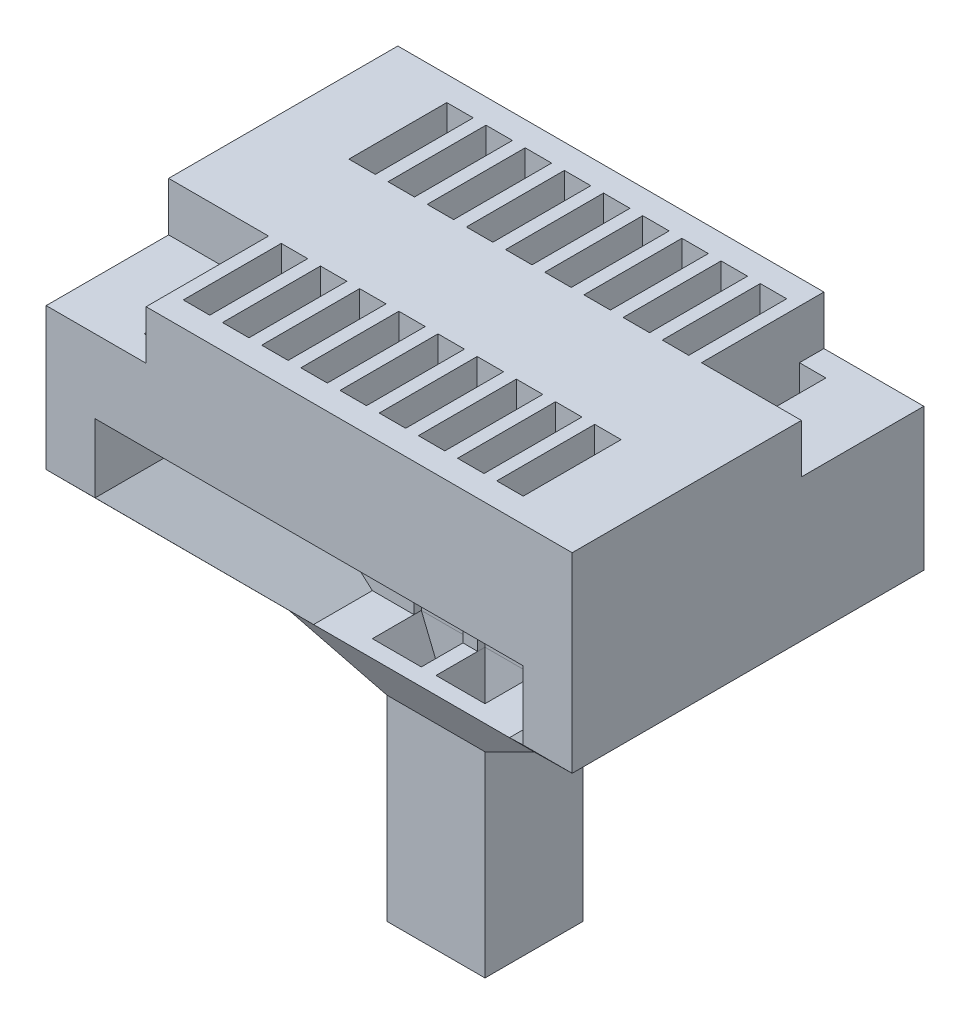
from build123d import *

# Parameters (mm, degrees)
MAIN_BLOCK_W               = 5.37
MAIN_BLOCK_H               = 3.59
MAIN_WELL_BLOCK_DEPTH      = 1.25
WELL_SKETCH_W              = 0.27
WELL_SKETCH_H              = 1
WELLS_DEPTH                = 2.54
SUPPORT_BEAMS_W            = 0.5
SUPPORT_BEAMS_H            = 3.59
SUPPORT_BEAMS_EXTR_DEPTH   = 0.7
WALL_DIVIDER_SKETCH_W      = 4.37
WALL_DIVIDER_SKETCH_H      = 0.3
DIVIDER_WALL_EXTR_DEPTH    = 0.7
LOWER_EXIT_BASE_SKETCH_2_W = 1
LOWER_EXIT_BASE_SKETCH_2_H = 1
TETRODE_GUIDE_TUBE_DEPTH   = 2
MID_TETRODE_HOLES_6_W      = 0.32
MID_TETRODE_HOLES_6_H      = 0.32
CUT_EXTRUDE3_DEPTH         = 2
TETRODE_GUIDE_TOP_8_W      = 0.5
TETRODE_GUIDE_TOP_8_H      = 0.5
CUT_EXTRUDE4_DEPTH         = 0.5
SKETCH9_W                  = 1.020059297
SKETCH9_H                  = 1.25
SKETCH9_W_2                = 1.02
GND_EXTR_DEPTH             = 0.5


with BuildPart() as part:
    # main block → Main Well Block (new body)
    with BuildSketch(Plane(origin=(0, 0, 0), x_dir=(1, 0, 0), z_dir=(0, 1, 0))):
        Rectangle(MAIN_BLOCK_W, MAIN_BLOCK_H)
    extrude(amount=-MAIN_WELL_BLOCK_DEPTH)

    # well sketch → wells (cut)
    with BuildSketch(Plane(origin=(0, 0, 0), x_dir=(1, 0, 0), z_dir=(0, 1, 0))):
        with Locations((1.8, 1.045)):
            Rectangle(WELL_SKETCH_W, WELL_SKETCH_H)
        with Locations((1.400006589, 1.045)):
            Rectangle(WELL_SKETCH_W, WELL_SKETCH_H)
        with Locations((1.000013177, 1.045)):
            Rectangle(WELL_SKETCH_W, WELL_SKETCH_H)
        with Locations((0.600019766, 1.045)):
            Rectangle(WELL_SKETCH_W, WELL_SKETCH_H)
        with Locations((0.200026354, 1.045)):
            Rectangle(WELL_SKETCH_W, WELL_SKETCH_H)
        with Locations((-0.199967057, 1.045)):
            Rectangle(WELL_SKETCH_W, WELL_SKETCH_H)
        with Locations((-0.599960468, 1.045)):
            Rectangle(WELL_SKETCH_W, WELL_SKETCH_H)
        with Locations((-0.99995388, 1.045)):
            Rectangle(WELL_SKETCH_W, WELL_SKETCH_H)
        with Locations((-1.399947291, 1.045)):
            Rectangle(WELL_SKETCH_W, WELL_SKETCH_H)
        with Locations((-1.799940703, 1.045)):
            Rectangle(WELL_SKETCH_W, WELL_SKETCH_H)
        with Locations((1.400006589, -1.045)):
            Rectangle(WELL_SKETCH_W, WELL_SKETCH_H)
        with Locations((1.000013177, -1.045)):
            Rectangle(WELL_SKETCH_W, WELL_SKETCH_H)
        with Locations((0.600019766, -1.045)):
            Rectangle(WELL_SKETCH_W, WELL_SKETCH_H)
        with Locations((0.200026354, -1.045)):
            Rectangle(WELL_SKETCH_W, WELL_SKETCH_H)
        with Locations((-0.199967057, -1.045)):
            Rectangle(WELL_SKETCH_W, WELL_SKETCH_H)
        with Locations((-0.599960468, -1.045)):
            Rectangle(WELL_SKETCH_W, WELL_SKETCH_H)
        with Locations((-0.99995388, -1.045)):
            Rectangle(WELL_SKETCH_W, WELL_SKETCH_H)
        with Locations((-1.399947291, -1.045)):
            Rectangle(WELL_SKETCH_W, WELL_SKETCH_H)
        with Locations((-1.799940703, -1.045)):
            Rectangle(WELL_SKETCH_W, WELL_SKETCH_H)
        with Locations((1.8, -1.045)):
            Rectangle(WELL_SKETCH_W, WELL_SKETCH_H)
    extrude(amount=-WELLS_DEPTH, mode=Mode.SUBTRACT)

    # support beams → support beams extr (add)
    with BuildSketch(Plane.XZ.offset(1.25)):
        with Locations((-2.435, 0)):
            Rectangle(SUPPORT_BEAMS_W, SUPPORT_BEAMS_H)
        with Locations((2.435, 0)):
            Rectangle(SUPPORT_BEAMS_W, SUPPORT_BEAMS_H)
    extrude(amount=SUPPORT_BEAMS_EXTR_DEPTH)

    # Sketch6 → section 1 of arm1
    with BuildSketch(Plane(origin=(0, -3, 0), x_dir=(1, 0, 0), z_dir=(0, 1, 0)), mode=Mode.PRIVATE) as arm1_s1:
        with BuildLine():
            Line((-1.25, 0.75), (-1, 0.75))
            Line((-1, 0.75), (-1, -0.75))
            Line((-1, -0.75), (-1.25, -0.75))
            Line((-1.25, -0.75), (-1.25, 0.75))
        make_face()
    # loft from a face of the part (arm1)
    loft([part.faces().sort_by_distance((-2.435, -1.95, 0))[0], arm1_s1.sketch])

    # Sketch7 → section 0 of arm2
    with BuildSketch(Plane(origin=(0, -3, 0), x_dir=(1, 0, 0), z_dir=(0, 1, 0)), mode=Mode.PRIVATE) as arm2_s0:
        with BuildLine():
            Line((1.25, 0.75), (1, 0.75))
            Line((1, 0.75), (1, -0.75))
            Line((1, -0.75), (1.25, -0.75))
            Line((1.25, -0.75), (1.25, 0.75))
        make_face()
    # loft up to a face of the part (arm2)
    loft([arm2_s0.sketch, part.faces().sort_by_distance((2.435, -1.95, 0))[0]])

    # wall divider sketch → divider wall extr (add)
    with BuildSketch(Plane(origin=(0, -1.25, 0), x_dir=(-1, 0, 0), z_dir=(0, -1, 0))):
        Rectangle(WALL_DIVIDER_SKETCH_W, WALL_DIVIDER_SKETCH_H)
    extrude(amount=DIVIDER_WALL_EXTR_DEPTH)

    # Sketch8 → section 1 of divider_wall
    with BuildSketch(Plane(origin=(0, -3, 0), x_dir=(1, 0, 0), z_dir=(0, 1, 0)), mode=Mode.PRIVATE) as divider_wall_s1:
        with BuildLine():
            Line((1.25, 0.15), (-1.25, 0.15))
            Line((-1.25, 0.15), (-1.25, -0.15))
            Line((-1.25, -0.15), (1.25, -0.15))
            Line((1.25, -0.15), (1.25, 0.15))
        make_face()
    # loft from a face of the part (divider_wall)
    loft([part.faces().sort_by_distance((0, -1.95, 0))[0], divider_wall_s1.sketch])

    # lower exit base sketch → exit base section 0
    with BuildSketch(Plane(origin=(0, -3.5, 0), x_dir=(1, 0, 0), z_dir=(0, 1, 0))):
        with BuildLine():
            Line((0.5, 0.5), (-0.5, 0.5))
            Line((-0.5, 0.5), (-0.5, -0.5))
            Line((-0.5, -0.5), (0.5, -0.5))
            Line((0.5, -0.5), (0.5, 0.5))
        make_face()
    # exit base sketch → exit base section 1
    with BuildSketch(Plane(origin=(0, -3, 0), x_dir=(1, 0, 0), z_dir=(0, 1, 0))):
        with BuildLine():
            Line((1.25, 0.75), (-1.25, 0.75))
            Line((-1.25, 0.75), (-1.25, -0.75))
            Line((-1.25, -0.75), (1.25, -0.75))
            Line((1.25, -0.75), (1.25, 0.75))
        make_face()
    loft()

    # lower exit base sketch<2> → tetrode guide tube (add)
    with BuildSketch(Plane(origin=(0, -3.5, 0), x_dir=(1, 0, 0), z_dir=(0, 1, 0))):
        Rectangle(LOWER_EXIT_BASE_SKETCH_2_W, LOWER_EXIT_BASE_SKETCH_2_H)
    extrude(amount=-TETRODE_GUIDE_TUBE_DEPTH)

    # mid tetrode holes → tet1 section 0
    with BuildSketch(Plane(origin=(0, -3.5, 0), x_dir=(1, 0, 0), z_dir=(0, 1, 0))):
        with BuildLine():
            Line((0.385, -0.065), (0.065, -0.065))
            Line((0.065, -0.065), (0.065, -0.385))
            Line((0.065, -0.385), (0.385, -0.385))
            Line((0.385, -0.385), (0.385, -0.065))
        make_face()
    # tetrode guide top → tet1 section 1
    with BuildSketch(Plane(origin=(0, -3, 0), x_dir=(1, 0, 0), z_dir=(0, 1, 0))):
        with BuildLine():
            Line((0.575, -0.075), (0.075, -0.075))
            Line((0.075, -0.075), (0.075, -0.575))
            Line((0.075, -0.575), (0.575, -0.575))
            Line((0.575, -0.575), (0.575, -0.075))
        make_face()
    loft(mode=Mode.SUBTRACT)

    # tetrode guide top<11> → tet2 section 0
    with BuildSketch(Plane(origin=(0, -3, 0), x_dir=(1, 0, 0), z_dir=(0, 1, 0))):
        with BuildLine():
            Line((-0.575, -0.075), (-0.075, -0.075))
            Line((-0.075, -0.075), (-0.075, -0.575))
            Line((-0.075, -0.575), (-0.575, -0.575))
            Line((-0.575, -0.575), (-0.575, -0.075))
        make_face()
    # mid tetrode holes<9> → tet2 section 1
    with BuildSketch(Plane(origin=(0, -3.5, 0), x_dir=(1, 0, 0), z_dir=(0, 1, 0))):
        with BuildLine():
            Line((-0.065, -0.065), (-0.385, -0.065))
            Line((-0.385, -0.065), (-0.385, -0.385))
            Line((-0.385, -0.385), (-0.065, -0.385))
            Line((-0.065, -0.385), (-0.065, -0.065))
        make_face()
    loft(mode=Mode.SUBTRACT)

    # tetrode guide top<12> → tet3 section 0
    with BuildSketch(Plane(origin=(0, -3, 0), x_dir=(1, 0, 0), z_dir=(0, 1, 0))):
        with BuildLine():
            Line((-0.075, 0.575), (-0.575, 0.575))
            Line((-0.575, 0.575), (-0.575, 0.075))
            Line((-0.575, 0.075), (-0.075, 0.075))
            Line((-0.075, 0.075), (-0.075, 0.575))
        make_face()
    # mid tetrode holes<10> → tet3 section 1
    with BuildSketch(Plane(origin=(0, -3.5, 0), x_dir=(1, 0, 0), z_dir=(0, 1, 0))):
        with BuildLine():
            Line((-0.065, 0.385), (-0.385, 0.385))
            Line((-0.385, 0.385), (-0.385, 0.065))
            Line((-0.385, 0.065), (-0.065, 0.065))
            Line((-0.065, 0.065), (-0.065, 0.385))
        make_face()
    loft(mode=Mode.SUBTRACT)

    # tetrode guide top<13> → tet4 section 0
    with BuildSketch(Plane(origin=(0, -3, 0), x_dir=(1, 0, 0), z_dir=(0, 1, 0))):
        with BuildLine():
            Line((0.075, 0.575), (0.575, 0.575))
            Line((0.575, 0.575), (0.575, 0.075))
            Line((0.575, 0.075), (0.075, 0.075))
            Line((0.075, 0.075), (0.075, 0.575))
        make_face()
    # mid tetrode holes<11> → tet4 section 1
    with BuildSketch(Plane(origin=(0, -3.5, 0), x_dir=(1, 0, 0), z_dir=(0, 1, 0))):
        with BuildLine():
            Line((0.385, 0.385), (0.065, 0.385))
            Line((0.065, 0.385), (0.065, 0.065))
            Line((0.065, 0.065), (0.385, 0.065))
            Line((0.385, 0.065), (0.385, 0.385))
        make_face()
    loft(mode=Mode.SUBTRACT)

    # mid tetrode holes<6> → Cut-Extrude3 (cut)
    with BuildSketch(Plane(origin=(0, -3.5, 0), x_dir=(1, 0, 0), z_dir=(0, 1, 0))):
        with Locations((-0.225, -0.225)):
            Rectangle(MID_TETRODE_HOLES_6_W, MID_TETRODE_HOLES_6_H)
        with Locations((0.225, -0.225)):
            Rectangle(MID_TETRODE_HOLES_6_W, MID_TETRODE_HOLES_6_H)
        with Locations((0.225, 0.225)):
            Rectangle(MID_TETRODE_HOLES_6_W, MID_TETRODE_HOLES_6_H)
        with Locations((-0.225, 0.225)):
            Rectangle(MID_TETRODE_HOLES_6_W, MID_TETRODE_HOLES_6_H)
    extrude(amount=-CUT_EXTRUDE3_DEPTH, mode=Mode.SUBTRACT)

    # tetrode guide top<8> → Cut-Extrude4 (cut)
    with BuildSketch(Plane(origin=(0, -3, 0), x_dir=(1, 0, 0), z_dir=(0, 1, 0))):
        with Locations((0.325, -0.325)):
            Rectangle(TETRODE_GUIDE_TOP_8_W, TETRODE_GUIDE_TOP_8_H)
        with Locations((-0.325, -0.325)):
            Rectangle(TETRODE_GUIDE_TOP_8_W, TETRODE_GUIDE_TOP_8_H)
        with Locations((0.325, 0.325)):
            Rectangle(TETRODE_GUIDE_TOP_8_W, TETRODE_GUIDE_TOP_8_H)
        with Locations((-0.325, 0.325)):
            Rectangle(TETRODE_GUIDE_TOP_8_W, TETRODE_GUIDE_TOP_8_H)
    extrude(amount=CUT_EXTRUDE4_DEPTH, mode=Mode.SUBTRACT)

    # Sketch9 → gnd_extr (cut)
    with BuildSketch(Plane(origin=(0, 0, 0), x_dir=(1, 0, 0), z_dir=(0, 1, 0))):
        with Locations((-2.174970351, -1.17)):
            Rectangle(SKETCH9_W, SKETCH9_H)
        with Locations((2.175, 1.17)):
            Rectangle(SKETCH9_W_2, SKETCH9_H)
    extrude(amount=-GND_EXTR_DEPTH, mode=Mode.SUBTRACT)


solid = part.part
